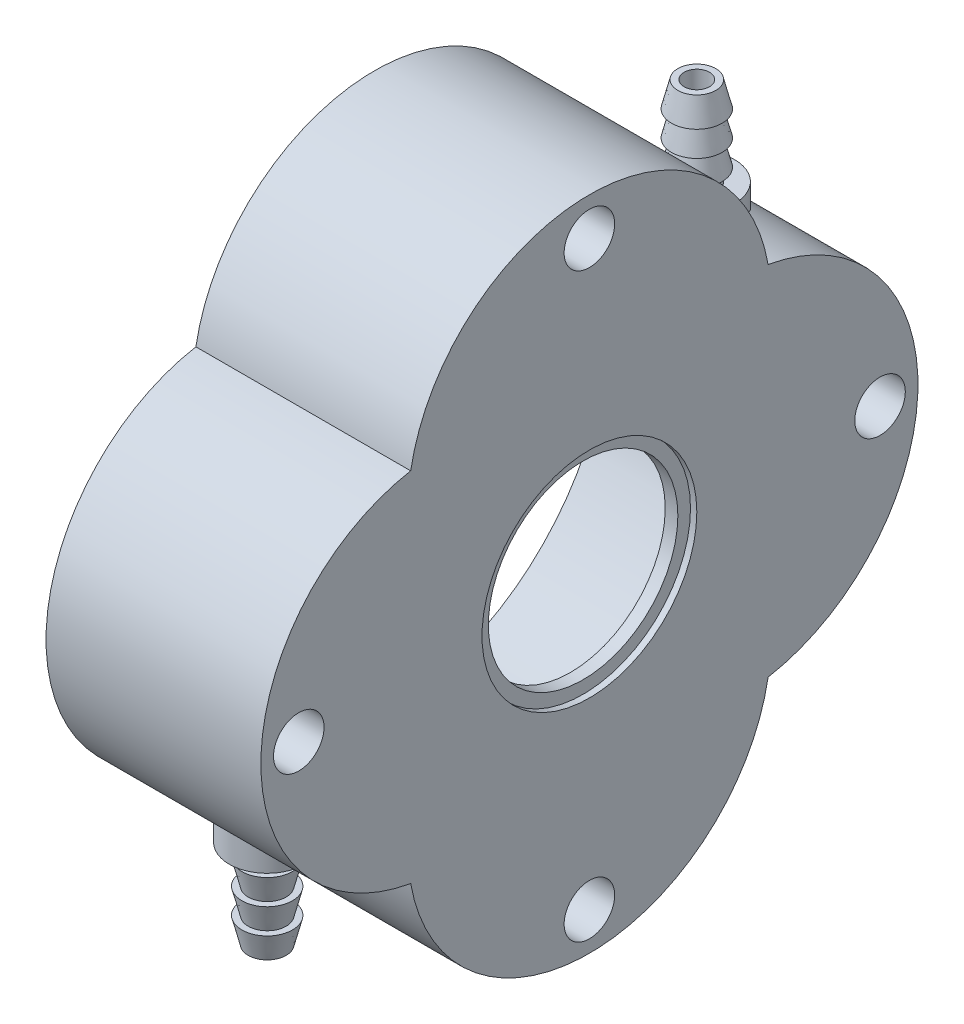
from build123d import *

# Parameters (mm, degrees)
SKETCH2_R           = 2
BODY_DEPTH          = 8.5
SKETCH10_R          = 7.5
CUT_EXTRUDE2_DEPTH  = 10
SKETCH3_R           = 8.5
O_RING_SEAT_DEPTH   = 0.5
SKETCH8_R           = 18
CAVITY_DEPTH        = 7
SKETCH5_R           = 1
OUTLET_DEPTH        = 38.739236876
BOSS_EXTRUDE2_REACH = 50.576
SKETCH6_R           = 3
SKETCH6_R_2         = 1
INLET_COUNT         = 2
CUT_EXTRUDE3_REACH  = 42.509
SKETCH11_R          = 18
SKETCH12_R          = 19.5
CUT_EXTRUDE4_DEPTH  = 0.5


with BuildPart() as part:
    # Sketch2 → Body (new, symmetric)
    with BuildSketch(Plane(origin=(0, 0, 0), x_dir=(0, 0, -1), z_dir=(1, 0, 0))):
        with BuildLine():
            ThreePointArc((-14.142135624, 14.142135624), (-26, 0), (-14.142135624, -14.142135624))
            ThreePointArc((-14.142135624, -14.142135624), (0, -26), (14.142135624, -14.142135624))
            ThreePointArc((14.142135624, -14.142135624), (26, 0), (14.142135624, 14.142135624))
            ThreePointArc((14.142135624, 14.142135624), (0, 26), (-14.142135624, 14.142135624))
        make_face()
        with Locations((0, 23)):
            Circle(SKETCH2_R, mode=Mode.SUBTRACT)
        with Locations((23, 0)):
            Circle(SKETCH2_R, mode=Mode.SUBTRACT)
        with Locations((0, -23)):
            Circle(SKETCH2_R, mode=Mode.SUBTRACT)
        with Locations((-23, 0)):
            Circle(SKETCH2_R, mode=Mode.SUBTRACT)
    extrude(amount=BODY_DEPTH, both=True)

    # Sketch10 → Cut-Extrude2 (cut)
    with BuildSketch(Plane(origin=(8.5, 0, 0), x_dir=(0, 0, -1), z_dir=(1, 0, 0))):
        Circle(SKETCH10_R)
    extrude(amount=-CUT_EXTRUDE2_DEPTH, mode=Mode.SUBTRACT)

    # Sketch3 → O-Ring Seat (cut)
    with BuildSketch(Plane(origin=(8.5, 0, 0), x_dir=(0, 0, -1), z_dir=(1, 0, 0))):
        Circle(SKETCH3_R)
    extrude(amount=-O_RING_SEAT_DEPTH, mode=Mode.SUBTRACT)

    # Sketch8 → Cavity (cut, symmetric)
    with BuildSketch(Plane.ZY):
        Circle(SKETCH8_R)
    extrude(amount=CAVITY_DEPTH, both=True, mode=Mode.SUBTRACT)

    # Sketch5 → Outlet (cut, through all)
    with BuildSketch(Plane(origin=(0, 0, 0), x_dir=(1, 0, 0), z_dir=(0, 1, 0))):
        with Locations(Location((0, 17, 0), (0, 0, 90))):
            Circle(SKETCH5_R)
    outlet = extrude(amount=OUTLET_DEPTH, mode=Mode.SUBTRACT)

    # Sketch6 → Boss-Extrude2 (add, up to next)
    with BuildSketch(Plane(origin=(0, 14.142135624, 0), x_dir=(1, 0, 0), z_dir=(0, 1, 0)), mode=Mode.PRIVATE) as boss_extrude2_sk1:
        with Locations((0, 17)):
            Circle(SKETCH6_R)
        with Locations(Location((0, 17, 0), (0, 0, 90))):
            Circle(SKETCH6_R_2, mode=Mode.SUBTRACT)
    boss_extrude2_tool1 = extrude(boss_extrude2_sk1.sketch, amount=-BOSS_EXTRUDE2_REACH, mode=Mode.PRIVATE) - part.part
    boss_extrude2 = boss_extrude2_tool1.solids().sort_by_distance((-2.915147, 14.142136, -17))[0]
    add(boss_extrude2)

    # Sketch9 → Revolve1 (revolve)
    with BuildSketch(Plane(origin=(0, 0, 0), x_dir=(0, 0, -1), z_dir=(1, 0, 0)), mode=Mode.PRIVATE) as revolve1_sk:
        Polygon((18, 14.142135624), (18, 21.142135624), (18.5, 21.142135624), (19, 19.142135624), (18.5, 19.142135624), (19, 17.142135624), (18.5, 17.142135624), (19, 15.142135624), (18.5, 15.142135624), (18.5, 14.142135624), align=None)
    revolve1 = revolve(revolve1_sk.sketch.rotate(Axis((0, 14.142135624, -17), (0, -1, 0)), 180), axis=Axis((0, 14.142135624, -17), (0, -1, 0)))

    # Inlet: Outlet, Boss-Extrude2, Revolve1 ×2 about axis
    inlet_axis = Axis((8, 0, 0), (1, 0, 0))
    add([outlet.rotate(inlet_axis, i * 360 / INLET_COUNT) for i in range(1, INLET_COUNT)], mode=Mode.SUBTRACT)
    add([boss_extrude2.rotate(inlet_axis, i * 360 / INLET_COUNT) for i in range(1, INLET_COUNT)])
    add([revolve1.rotate(inlet_axis, i * 360 / INLET_COUNT) for i in range(1, INLET_COUNT)])

    # Sketch11 → Cut-Extrude3 (cut, up to next)
    with BuildSketch(Plane.ZY.offset(8.5), mode=Mode.PRIVATE) as cut_extrude3_sk1:
        Circle(SKETCH11_R)
    cut_extrude3_tool1 = extrude(cut_extrude3_sk1.sketch, amount=-CUT_EXTRUDE3_REACH, mode=Mode.PRIVATE) & part.part
    add(cut_extrude3_tool1.solids().sort_by_distance((-8.5, 0, 0))[0], mode=Mode.SUBTRACT)

    # Sketch12 → Cut-Extrude4 (cut)
    with BuildSketch(Plane.ZY.offset(8.5)):
        Circle(SKETCH12_R)
    extrude(amount=-CUT_EXTRUDE4_DEPTH, mode=Mode.SUBTRACT)


solid = part.part
